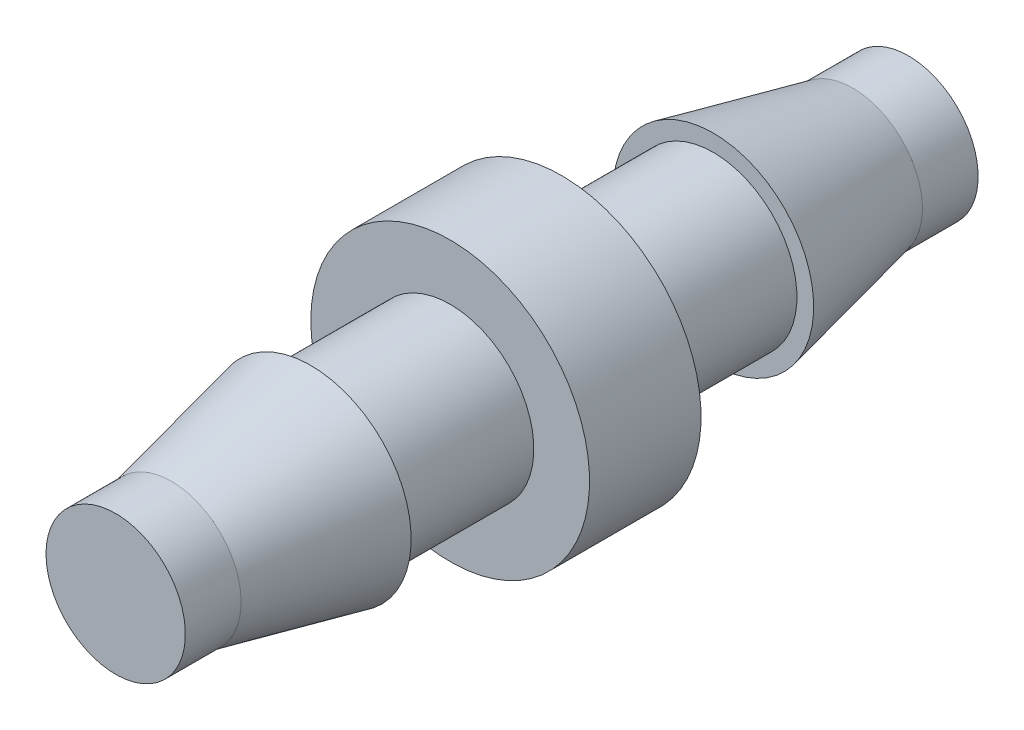
from build123d import *


with BuildPart() as part:
    # Sketch1 → Revolve1 (revolve)
    with BuildSketch(Plane(origin=(0, 0, 0), x_dir=(0, 0, -1), z_dir=(1, 0, 0)), mode=Mode.PRIVATE) as revolve1_sk:
        Polygon((0, 0), (0, 3.175), (2.54, 3.175), (8.89, 4.572), (8.89, 3.81), (15.24, 3.81), (15.24, 6.35), (20.32, 6.35), (20.8788, 3.81), (27.2288, 3.81), (27.2288, 4.572), (33.5788, 3.175), (36.1188, 3.175), (36.1188, 0), align=None)
    revolve(revolve1_sk.sketch.rotate(Axis((0, 0, -36.1188), (0, 0, 1)), 90), axis=Axis((0, 0, -36.1188), (0, 0, 1)))


solid = part.part
